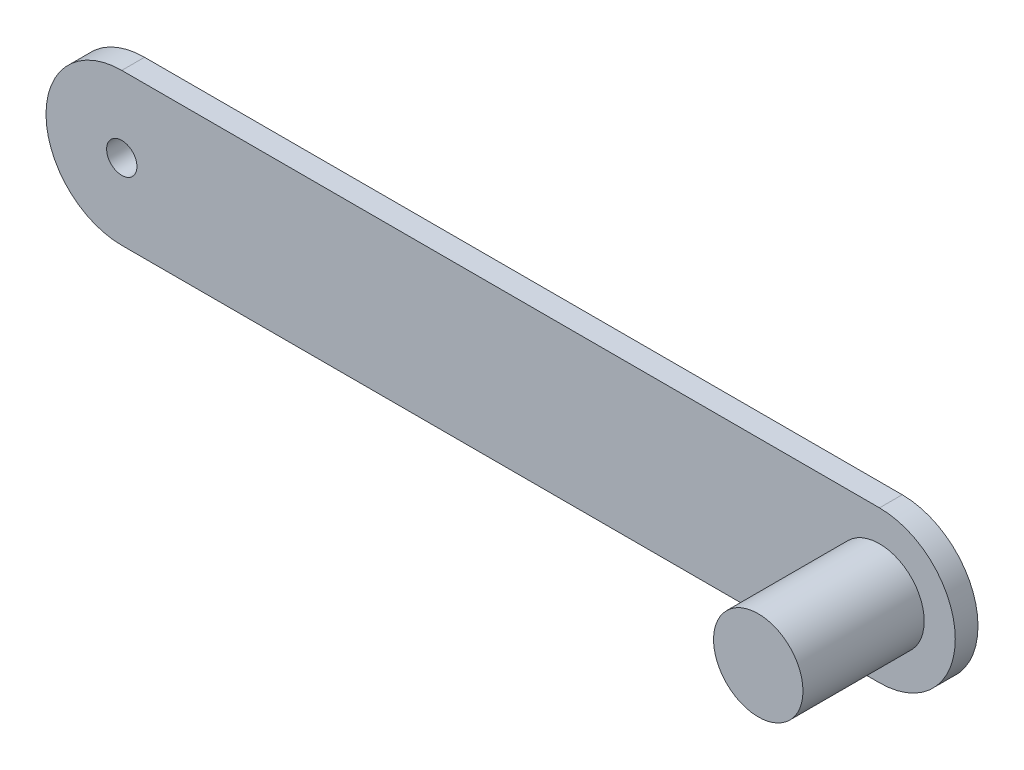
from build123d import *

# Parameters (mm, degrees)
BOSS_EXTRUDE4_DEPTH = 1.5
SKETCH4_R           = 1
CUT_EXTRUDE1_DEPTH  = 56.247171873
SKETCH5_R           = 2.95
BOSS_EXTRUDE5_DEPTH = 8


with BuildPart() as part:
    # Sketch1 → Boss-Extrude4 (new body)
    with BuildSketch(Plane.XY):
        with BuildLine():
            Line((0, 5), (50, 5))
            ThreePointArc((50, 5), (55, 0), (50, -5))
            Line((50, -5), (0, -5))
            ThreePointArc((0, -5), (-5, 0), (0, 5))
        make_face()
    extrude(amount=BOSS_EXTRUDE4_DEPTH)

    # Sketch4 → Cut-Extrude1 (cut, through all)
    with BuildSketch(Plane.XY.offset(1.5)):
        Circle(SKETCH4_R)
    extrude(amount=-CUT_EXTRUDE1_DEPTH, mode=Mode.SUBTRACT)

    # Sketch5 → Boss-Extrude5 (add)
    with BuildSketch(Plane.XY.offset(1.5)):
        with Locations((50, 0)):
            Circle(SKETCH5_R)
    extrude(amount=BOSS_EXTRUDE5_DEPTH)


solid = part.part
